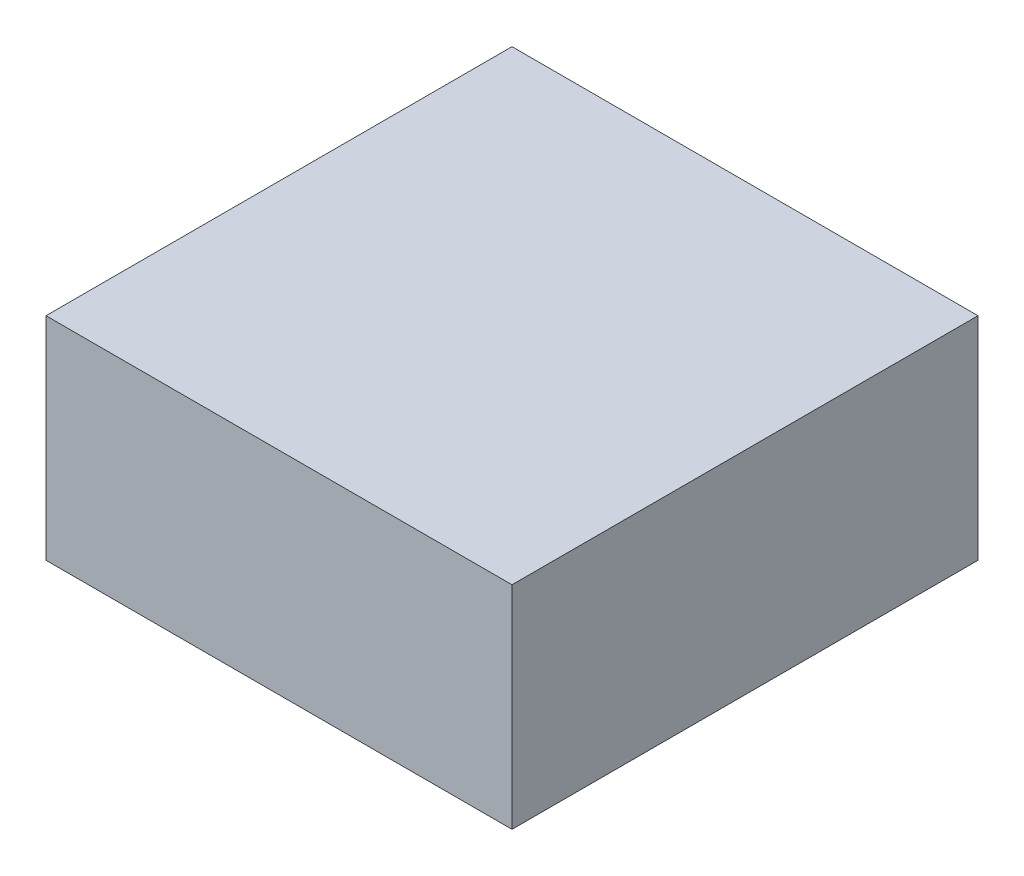
from build123d import *

# Parameters (mm, degrees)
SKETCH1_W           = 279.4
SKETCH1_H           = 279.4
BOSS_EXTRUDE1_DEPTH = 127


with BuildPart() as part:
    # Sketch1 → Boss-Extrude1 (new body)
    with BuildSketch(Plane(origin=(0, 0, 0), x_dir=(1, 0, 0), z_dir=(0, 1, 0))):
        Rectangle(SKETCH1_W, SKETCH1_H)
    extrude(amount=BOSS_EXTRUDE1_DEPTH)


solid = part.part
